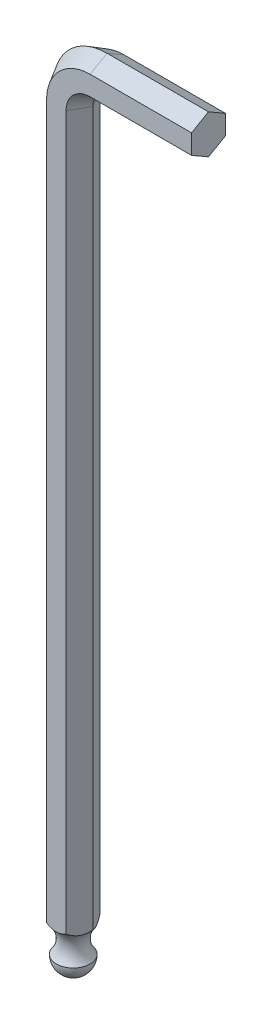
from build123d import *


with BuildPart() as part:
    # Austragung4: sweep along a path in Skizze1
    with BuildLine(Plane.XY) as austragung4_path:
        Line((0, 0), (0, 220))
        ThreePointArc((0, 220), (2.928932188, 227.071067812), (10, 230))
        Line((10, 230), (40, 230))
    # Skizze3 → Austragung4 (sweep)
    with BuildSketch(Plane(origin=(0, 0, 0), x_dir=(1, 0, 0), z_dir=(0, 1, 0))):
        Polygon((-2.886751346, 5), (-5.773502692, 0), (-2.886751346, -5), (2.886751346, -5), (5.773502692, 0), (2.886751346, 5), align=None)
    sweep(path=austragung4_path.line)

    # Skizze6 → Rotation5 (revolve)
    with BuildSketch(Plane(origin=(0, 0, 0), x_dir=(0, 0, -1), z_dir=(1, 0, 0))):
        with BuildLine():
            Line((0, -5), (0, 5))
            ThreePointArc((0, 5), (5, 0), (0, -5))
        make_face()
    revolve(axis=Axis((0, 7.810357944, 0), (0, -1, 0)))

    # Skizze8 → Schnitt-Rotation1 (revolve, cut)
    with BuildSketch(Plane.XY, mode=Mode.PRIVATE) as schnitt_rotation1_sk:
        with BuildLine():
            Line((-5.773502692, -0.9), (-5.109556776, -0.12318299))
            ThreePointArc((-5.109556776, -0.12318299), (-3.550682703, 4.1), (-5.109556776, 8.32318299))
            Line((-5.109556776, 8.32318299), (-5.773502692, 9.1))
            Line((-5.773502692, 9.1), (-5.773502692, -0.9))
        make_face()
    revolve(schnitt_rotation1_sk.sketch.rotate(Axis((0, 0, 0), (0, 1, 0)), 266.99718795), axis=Axis((0, 0, 0), (0, 1, 0)), mode=Mode.SUBTRACT)


solid = part.part
